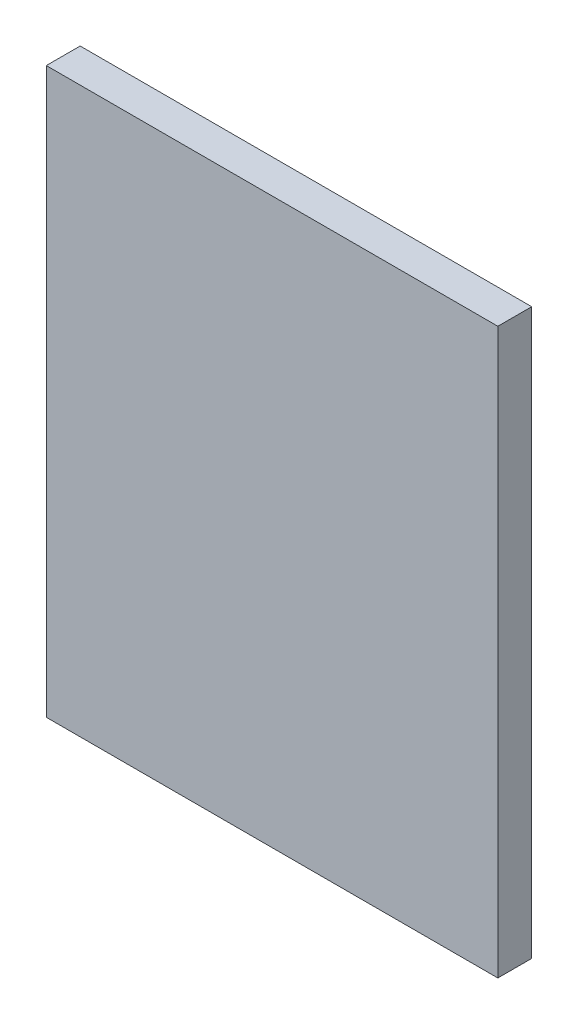
from build123d import *

# Parameters (mm, degrees)
SKETCH1_W           = 80
SKETCH1_H           = 100
BOSS_EXTRUDE1_DEPTH = 6


with BuildPart() as part:
    # Sketch1 → Boss-Extrude1 (new body)
    with BuildSketch(Plane.XY):
        Rectangle(SKETCH1_W, SKETCH1_H)
    extrude(amount=BOSS_EXTRUDE1_DEPTH)


solid = part.part
